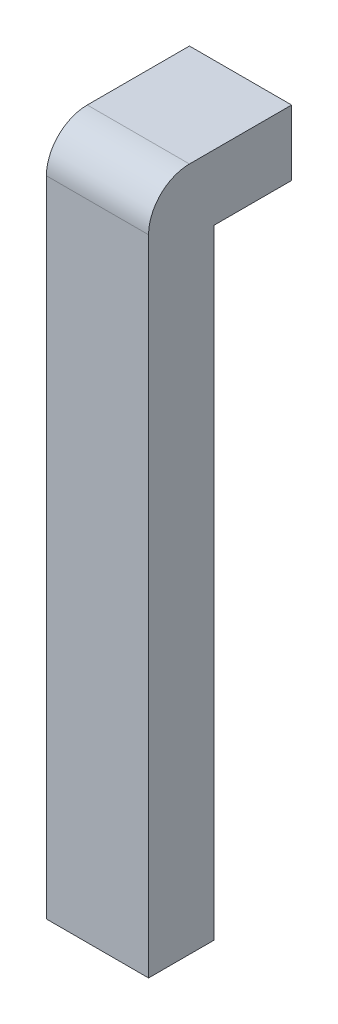
from build123d import *

# Parameters (mm, degrees)
SKETCH_1_W          = 50
SKETCH_1_H          = 55
EXTRUDE_1_DEPTH     = 70
SKETCH_3_W          = 50
SKETCH_3_H          = 25
CUT_EXTRUDE_1_DEPTH = 38
SKETCH_4_W          = 25.5
SKETCH_4_H          = 36
CUT_EXTRUDE_2_DEPTH = 22
SKETCH_12_W         = 25.5
SKETCH_12_H         = 1
EXTRUDE_2_DEPTH     = 19
EXTRUDE_3_DEPTH     = 2
SKETCH_16_W         = 50
SKETCH_16_H         = 32
EXTRUDE_5_DEPTH     = 280
FILLET_1_R          = 20
SKETCH_23_R         = 1
CUT_EXTRUDE_3_DEPTH = 10


with BuildPart() as part:
    # 草图1 → 凸台-拉伸1 (new body)
    with BuildSketch(Plane.XY):
        with Locations((25, 27.5)):
            Rectangle(SKETCH_1_W, SKETCH_1_H)
    extrude(amount=EXTRUDE_1_DEPTH)

    # 草图3 → 切除-拉伸1 (cut)
    with BuildSketch(Plane(origin=(0, 0, 0), x_dir=(-1, 0, 0), z_dir=(0, 0, -1))):
        with Locations((-25, 12.5)):
            Rectangle(SKETCH_3_W, SKETCH_3_H)
    extrude(amount=-CUT_EXTRUDE_1_DEPTH, mode=Mode.SUBTRACT)

    # 草图4 → 切除-拉伸2 (cut)
    with BuildSketch(Plane.XZ.offset(-25)):
        with Locations((24.95, 20)):
            Rectangle(SKETCH_4_W, SKETCH_4_H)
    extrude(amount=-CUT_EXTRUDE_2_DEPTH, mode=Mode.SUBTRACT)

    # 草图12 → 凸台-拉伸2 (add)
    with BuildSketch(Plane.XZ.offset(-47)):
        with Locations((24.95, 37.5)):
            Rectangle(SKETCH_12_W, SKETCH_12_H)
    extrude(amount=EXTRUDE_2_DEPTH)

    # 草图13 → 凸台-拉伸3 (add)
    with BuildSketch(Plane.XZ.offset(-25)):
        Polygon((12.2, 38), (0, 38), (0, 0), (50, 0), (50, 38), (37.7, 38), (37.7, 2), (12.2, 2), align=None)
    extrude(amount=EXTRUDE_3_DEPTH)

    # 草图16 → 凸台-拉伸5 (add)
    with BuildSketch(Plane.XZ):
        with Locations((25, 54)):
            Rectangle(SKETCH_16_W, SKETCH_16_H)
    extrude(amount=EXTRUDE_5_DEPTH)

    # 圆角1
    fillet_1_edges = [part.edges().sort_by_distance(p)[0] for p in [
        (25, 55, 70),
    ]]
    fillet(fillet_1_edges, radius=FILLET_1_R)

    # 草图23 → 切除-拉伸3 (cut)
    with BuildSketch(Plane(origin=(0, 0, 0), x_dir=(-1, 0, 0), z_dir=(0, 0, -1))):
        with Locations((-15.2, 44.140200043)):
            Circle(SKETCH_23_R)
        with Locations((-34.8, 44.140200043)):
            Circle(SKETCH_23_R)
    extrude(amount=-CUT_EXTRUDE_3_DEPTH, mode=Mode.SUBTRACT)


solid = part.part
